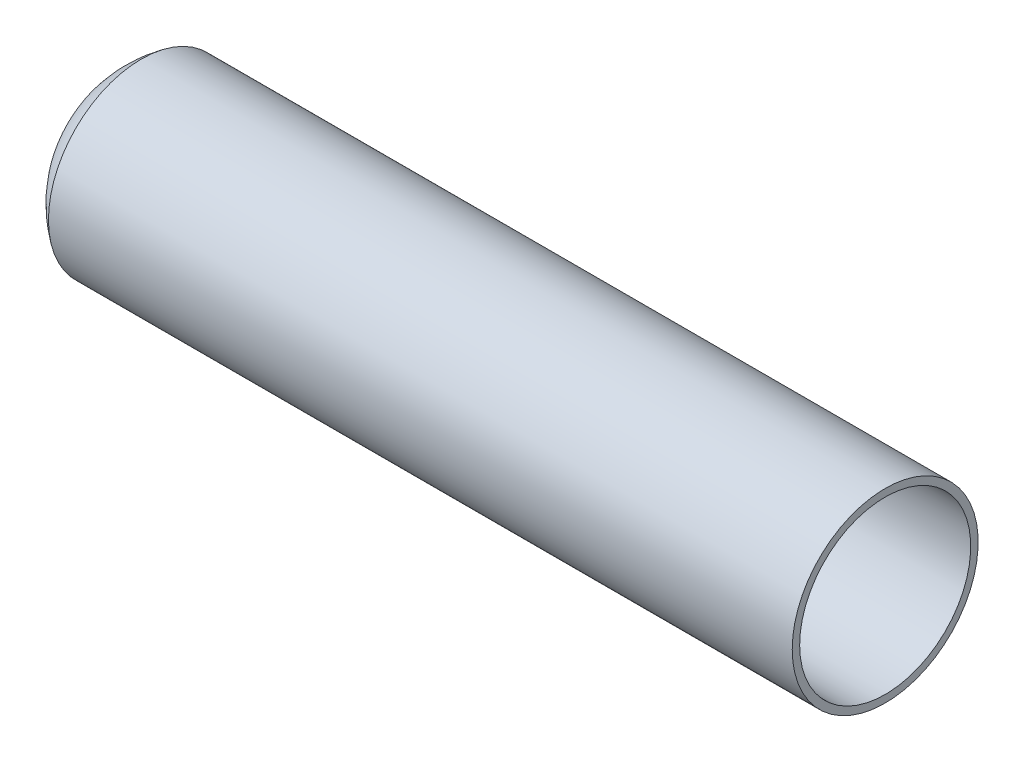
from build123d import *


with BuildPart() as part:
    # Esquisse2 → Base-Révol.-Mince (revolve)
    with BuildSketch(Plane.XY, mode=Mode.PRIVATE) as base_r_vol_mince_sk:
        with BuildLine():
            Line((14.2, 0), (14.2, 11))
            ThreePointArc((14.2, 11), (18.654416078, 18.821530225), (25.2, 25))
            Line((25.2, 25), (225.2, 25))
            Line((225.2, 25), (225.2, 23))
            Line((225.2, 23), (25.839503623, 23))
            ThreePointArc((25.839503623, 23), (20.149855755, 17.487189999), (16.2, 10.619744587))
            Line((16.2, 10.619744587), (16.2, 0))
            Line((16.2, 0), (14.2, 0))
        make_face()
    revolve(base_r_vol_mince_sk.sketch.rotate(Axis((14.2, 0, 0), (1, 0, 0)), 90), axis=Axis((14.2, 0, 0), (1, 0, 0)))


solid = part.part
